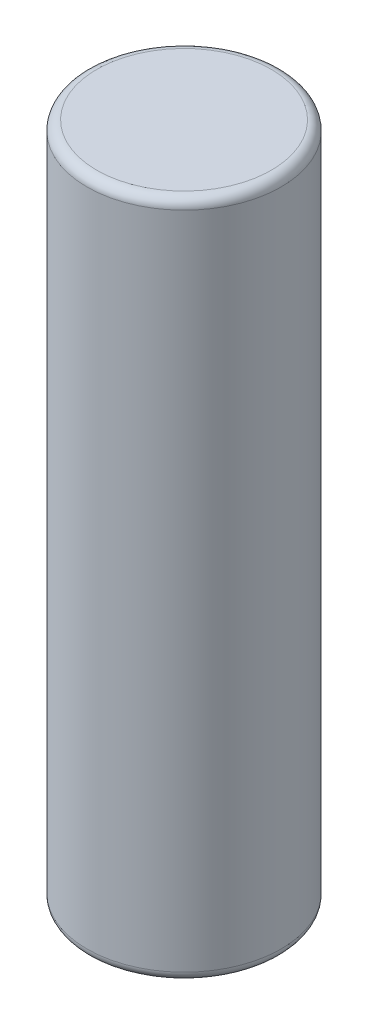
from build123d import *

# Parameters (mm, degrees)
SKETCH1_R           = 1
BOSS_EXTRUDE1_DEPTH = 7
FILLET1_R           = 0.1


with BuildPart() as part:
    # Sketch1 → Boss-Extrude1 (new body)
    with BuildSketch(Plane(origin=(0, 0, 0), x_dir=(1, 0, 0), z_dir=(0, 1, 0))):
        with Locations(Location((0, 0, 0), (0, 0, 270))):
            Circle(SKETCH1_R)
    extrude(amount=BOSS_EXTRUDE1_DEPTH)

    # Fillet1
    fillet1_edges = [part.edges().sort_by_distance(p)[0] for p in [
        (0, 0, -1),
        (0, 7, -1),
    ]]
    fillet(fillet1_edges, radius=FILLET1_R)


solid = part.part
